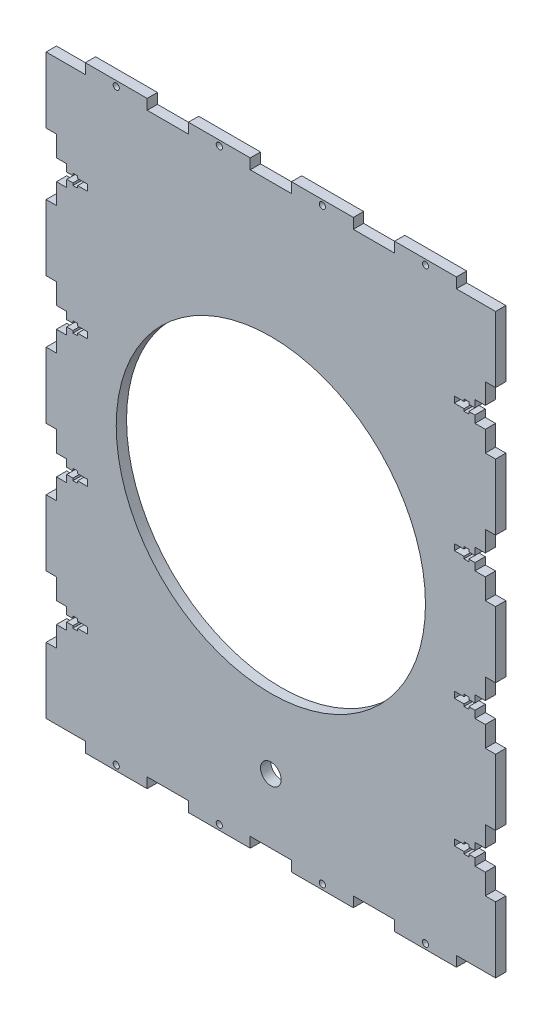
from build123d import *

# Parameters (mm, degrees)
SKETCH1_R           = 1.5
SKETCH1_R_2         = 5
SKETCH1_R_3         = 75
BOSS_EXTRUDE1_DEPTH = 5


with BuildPart() as part:
    # Sketch1 → Boss-Extrude1 (new body)
    with BuildSketch(Plane.XY):
        Polygon((-90, 145.000003033), (-90, 140.000003033), (-109, 140.000003033), (-109, 108.00000182), (-104, 108.00000182), (-104, 98.00000182), (-99.000966482, 98.00000182), (-99.000966482, 94.50000182), (-96.000966482, 94.50000182), (-96.000966482, 95.60000182), (-93.700966482, 95.60000182), (-93.700966482, 94.50000182), (-89.000966482, 94.50000182), (-89.000966482, 91.50000182), (-93.700966482, 91.50000182), (-93.700966482, 90.40000182), (-96.000966482, 90.40000182), (-96.000966482, 91.50000182), (-99.000966482, 91.50000182), (-99.000966482, 88.00000182), (-104, 88.00000182), (-104, 78.00000182), (-109, 78.00000182), (-109, 46.000000607), (-104, 46.000000607), (-104, 36.000000607), (-99.000966482, 36.000000607), (-99.000966482, 32.500000607), (-96.000966482, 32.500000607), (-96.000966482, 33.600000607), (-93.700966482, 33.600000607), (-93.700966482, 32.500000607), (-89.000966482, 32.500000607), (-89.000966482, 29.500000607), (-93.700966482, 29.500000607), (-93.700966482, 28.400000607), (-96.000966482, 28.400000607), (-96.000966482, 29.500000607), (-99.000966482, 29.500000607), (-99.000966482, 26.000000607), (-104, 26.000000607), (-104, 16.000000607), (-109, 16.000000607), (-109, -16.000000607), (-104, -16.000000607), (-104, -26.000000607), (-99.000966482, -26.000000607), (-99.000966482, -29.500000607), (-96.000966482, -29.500000607), (-96.000966482, -28.400000607), (-93.700966482, -28.400000607), (-93.700966482, -29.500000607), (-89.000966482, -29.500000607), (-89.000966482, -32.500000607), (-93.700966482, -32.500000607), (-93.700966482, -33.600000607), (-96.000966482, -33.600000607), (-96.000966482, -32.500000607), (-99.000966482, -32.500000607), (-99.000966482, -36.000000607), (-104, -36.000000607), (-104, -46.000000607), (-109, -46.000000607), (-109, -78.00000182), (-104, -78.00000182), (-104, -88.00000182), (-99.000966482, -88.00000182), (-99.000966482, -91.50000182), (-96.000966482, -91.50000182), (-96.000966482, -90.40000182), (-93.700966482, -90.40000182), (-93.700966482, -91.50000182), (-89.000966482, -91.50000182), (-89.000966482, -94.50000182), (-93.700966482, -94.50000182), (-93.700966482, -95.60000182), (-96.000966482, -95.60000182), (-96.000966482, -94.50000182), (-99.000966482, -94.50000182), (-99.000966482, -98.00000182), (-104, -98.00000182), (-104, -108.00000182), (-109, -108.00000182), (-109, -140.000003033), (-90, -140.000003033), (-90, -145.000003033), (-60, -145.000003033), (-60, -140.000003033), (-40, -140.000003033), (-40, -145.000003033), (-10, -145.000003033), (-10, -140.000003033), (10, -140.000003033), (10, -145.000003033), (40, -145.000003033), (40, -140.000003033), (60, -140.000003033), (60, -145.000003033), (90, -145.000003033), (90, -140.000003033), (109, -140.000003033), (109, -108.00000182), (104, -108.00000182), (104, -98.00000182), (99.000966482, -98.00000182), (99.000966482, -94.50000182), (96.000966482, -94.50000182), (96.000966482, -95.60000182), (93.700966482, -95.60000182), (93.700966482, -94.50000182), (89.000966482, -94.50000182), (89.000966482, -91.50000182), (93.700966482, -91.50000182), (93.700966482, -90.40000182), (96.000966482, -90.40000182), (96.000966482, -91.50000182), (99.000966482, -91.50000182), (99.000966482, -88.00000182), (104, -88.00000182), (104, -78.00000182), (109, -78.00000182), (109, -46.000000607), (104, -46.000000607), (104, -36.000000607), (99.000966482, -36.000000607), (99.000966482, -32.500000607), (96.000966482, -32.500000607), (96.000966482, -33.600000607), (93.700966482, -33.600000607), (93.700966482, -32.500000607), (89.000966482, -32.500000607), (89.000966482, -29.500000607), (93.700966482, -29.500000607), (93.700966482, -28.400000607), (96.000966482, -28.400000607), (96.000966482, -29.500000607), (99.000966482, -29.500000607), (99.000966482, -26.000000607), (104, -26.000000607), (104, -16.000000607), (109, -16.000000607), (109, 16.000000607), (104, 16.000000607), (104, 26.000000607), (99.000966482, 26.000000607), (99.000966482, 29.500000607), (96.000966482, 29.500000607), (96.000966482, 28.400000607), (93.700966482, 28.400000607), (93.700966482, 29.500000607), (89.000966482, 29.500000607), (89.000966482, 32.500000607), (93.700966482, 32.500000607), (93.700966482, 33.600000607), (96.000966482, 33.600000607), (96.000966482, 32.500000607), (99.000966482, 32.500000607), (99.000966482, 36.000000607), (104, 36.000000607), (104, 46.000000607), (109, 46.000000607), (109, 78.00000182), (104, 78.00000182), (104, 88.00000182), (99.000966482, 88.00000182), (99.000966482, 91.50000182), (96.000966482, 91.50000182), (96.000966482, 90.40000182), (93.700966482, 90.40000182), (93.700966482, 91.50000182), (89.000966482, 91.50000182), (89.000966482, 94.50000182), (93.700966482, 94.50000182), (93.700966482, 95.60000182), (96.000966482, 95.60000182), (96.000966482, 94.50000182), (99.000966482, 94.50000182), (99.000966482, 98.00000182), (104, 98.00000182), (104, 108.00000182), (109, 108.00000182), (109, 140.000003033), (90, 140.000003033), (90, 145.000003033), (60, 145.000003033), (60, 140.000003033), (40, 140.000003033), (40, 145.000003033), (10, 145.000003033), (10, 140.000003033), (-10, 140.000003033), (-10, 145.000003033), (-40, 145.000003033), (-40, 140.000003033), (-60, 140.000003033), (-60, 145.000003033), align=None)
        with Locations((-75, -142.500003033)):
            Circle(SKETCH1_R, mode=Mode.SUBTRACT)
        with Locations((-25, -142.500003033)):
            Circle(SKETCH1_R, mode=Mode.SUBTRACT)
        with Locations((25, -142.500003033)):
            Circle(SKETCH1_R, mode=Mode.SUBTRACT)
        with Locations((0, -108.739893094)):
            Circle(SKETCH1_R_2, mode=Mode.SUBTRACT)
        with Locations((75, -142.500003033)):
            Circle(SKETCH1_R, mode=Mode.SUBTRACT)
        with Locations((-75, 142.500003033)):
            Circle(SKETCH1_R, mode=Mode.SUBTRACT)
        with Locations((-25, 142.500003033)):
            Circle(SKETCH1_R, mode=Mode.SUBTRACT)
        Circle(SKETCH1_R_3, mode=Mode.SUBTRACT)
        with Locations((25, 142.500003033)):
            Circle(SKETCH1_R, mode=Mode.SUBTRACT)
        with Locations((75, 142.500003033)):
            Circle(SKETCH1_R, mode=Mode.SUBTRACT)
    extrude(amount=BOSS_EXTRUDE1_DEPTH)


solid = part.part
